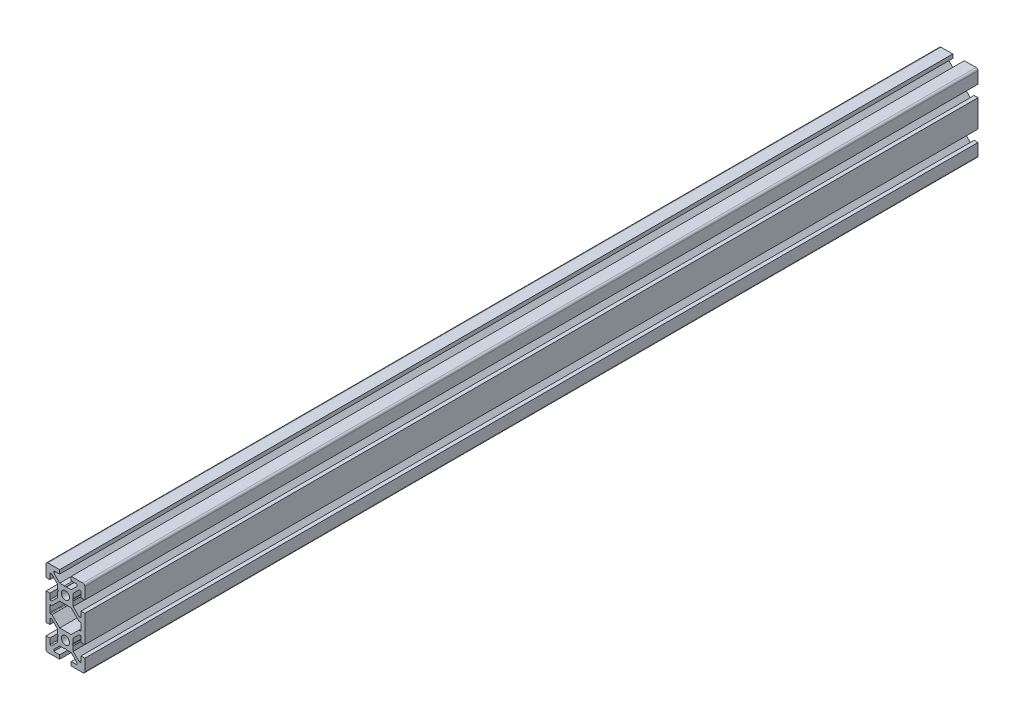
from build123d import *

# Parameters (mm, degrees)
BOSS_EXTRUDE1_DEPTH = 460
SKETCH2_W           = 460
SKETCH2_H           = 2.1
SKETCH3_W           = 460
SKETCH3_H           = 2.1


with BuildPart() as part:
    # Sketch1 → Boss-Extrude1 (new body)
    with BuildSketch(Plane.XY):
        with BuildLine():
            Line((-9, -20), (-3, -20))
            Line((-3, -20), (-3, -18))
            Line((-3, -18), (-6, -18))
            Line((-6, -18), (-6, -17.060660172))
            Line((-6, -17.060660172), (-2.939339828, -14))
            Line((-2.939339828, -14), (-0.519615242, -14))
            Line((-0.519615242, -14), (0, -13.7))
            Line((0, -13.7), (0.519615242, -14))
            Line((0.519615242, -14), (2.939339828, -14))
            Line((2.939339828, -14), (6, -17.060660172))
            Line((6, -17.060660172), (6, -18))
            Line((6, -18), (3, -18))
            Line((3, -18), (3, -20))
            Line((3, -20), (9, -20))
            ThreePointArc((9, -20), (9.707106781, -19.707106781), (10, -19))
            Line((10, -19), (10, -13))
            Line((10, -13), (8, -13))
            Line((8, -13), (8, -16))
            Line((8, -16), (7.060660172, -16))
            Line((7.060660172, -16), (4, -12.939339828))
            Line((4, -12.939339828), (4, -10.519615242))
            Line((4, -10.519615242), (3.7, -10))
            Line((3.7, -10), (4, -9.480384758))
            Line((4, -9.480384758), (4, -7.060660172))
            Line((4, -7.060660172), (7.060660172, -4))
            Line((7.060660172, -4), (8, -4))
            Line((8, -4), (8, -7))
            Line((8, -7), (10, -7))
            Line((10, -7), (10, 7))
            Line((10, 7), (8, 7))
            Line((8, 7), (8, 4))
            Line((8, 4), (7.060660172, 4))
            Line((7.060660172, 4), (4, 7.060660172))
            Line((4, 7.060660172), (4, 9.480384758))
            Line((4, 9.480384758), (3.7, 10))
            Line((3.7, 10), (4, 10.519615242))
            Line((4, 10.519615242), (4, 12.939339828))
            Line((4, 12.939339828), (7.060660172, 16))
            Line((7.060660172, 16), (8, 16))
            Line((8, 16), (8, 13))
            Line((8, 13), (10, 13))
            Line((10, 13), (10, 19))
            ThreePointArc((10, 19), (9.707106781, 19.707106781), (9, 20))
            Line((9, 20), (3, 20))
            Line((3, 20), (3, 18))
            Line((3, 18), (6, 18))
            Line((6, 18), (6, 17.060660172))
            Line((6, 17.060660172), (2.939339828, 14))
            Line((2.939339828, 14), (0.519615242, 14))
            Line((0.519615242, 14), (0, 13.7))
            Line((0, 13.7), (-0.519615242, 14))
            Line((-0.519615242, 14), (-2.939339828, 14))
            Line((-2.939339828, 14), (-6, 17.060660172))
            Line((-6, 17.060660172), (-6, 18))
            Line((-6, 18), (-3, 18))
            Line((-3, 18), (-3, 20))
            Line((-3, 20), (-9, 20))
            ThreePointArc((-9, 20), (-9.707106781, 19.707106781), (-10, 19))
            Line((-10, 19), (-10, 13))
            Line((-10, 13), (-8, 13))
            Line((-8, 13), (-8, 16))
            Line((-8, 16), (-7.060660172, 16))
            Line((-7.060660172, 16), (-4, 12.939339828))
            Line((-4, 12.939339828), (-4, 10.519615242))
            Line((-4, 10.519615242), (-3.7, 10))
            Line((-3.7, 10), (-4, 9.480384758))
            Line((-4, 9.480384758), (-4, 7.060660172))
            Line((-4, 7.060660172), (-7.060660172, 4))
            Line((-7.060660172, 4), (-8, 4))
            Line((-8, 4), (-8, 7))
            Line((-8, 7), (-10, 7))
            Line((-10, 7), (-10, -7))
            Line((-10, -7), (-8, -7))
            Line((-8, -7), (-8, -4))
            Line((-8, -4), (-7.060660172, -4))
            Line((-7.060660172, -4), (-4, -7.060660172))
            Line((-4, -7.060660172), (-4, -9.480384758))
            Line((-4, -9.480384758), (-3.7, -10))
            Line((-3.7, -10), (-4, -10.519615242))
            Line((-4, -10.519615242), (-4, -12.939339828))
            Line((-4, -12.939339828), (-7.060660172, -16))
            Line((-7.060660172, -16), (-8, -16))
            Line((-8, -16), (-8, -13))
            Line((-8, -13), (-10, -13))
            Line((-10, -13), (-10, -19))
            ThreePointArc((-10, -19), (-9.707106781, -19.707106781), (-9, -20))
        make_face()
        with BuildLine():
            Line((-7.7, -2), (-7.063603897, -2))
            ThreePointArc((-7.063603897, -2), (-6.948798867, -2.02283614), (-6.851471863, -2.087867966))
            Line((-6.851471863, -2.087867966), (-2.939339828, -6))
            Line((-2.939339828, -6), (2.939339828, -6))
            Line((2.939339828, -6), (6.851471863, -2.087867966))
            ThreePointArc((6.851471863, -2.087867966), (6.948798867, -2.02283614), (7.063603897, -2))
            Line((7.063603897, -2), (7.7, -2))
            ThreePointArc((7.7, -2), (7.912132034, -1.912132034), (8, -1.7))
            Line((8, -1.7), (8, 1.7))
            ThreePointArc((8, 1.7), (7.912132034, 1.912132034), (7.7, 2))
            Line((7.7, 2), (7.063603897, 2))
            ThreePointArc((7.063603897, 2), (6.948798867, 2.02283614), (6.851471863, 2.087867966))
            Line((6.851471863, 2.087867966), (2.939339828, 6))
            Line((2.939339828, 6), (-2.939339828, 6))
            Line((-2.939339828, 6), (-6.851471863, 2.087867966))
            ThreePointArc((-6.851471863, 2.087867966), (-6.948798867, 2.02283614), (-7.063603897, 2))
            Line((-7.063603897, 2), (-7.7, 2))
            ThreePointArc((-7.7, 2), (-7.912132034, 1.912132034), (-8, 1.7))
            Line((-8, 1.7), (-8, -1.7))
            ThreePointArc((-8, -1.7), (-7.912132034, -1.912132034), (-7.7, -2))
        make_face(mode=Mode.SUBTRACT)
    extrude(amount=-BOSS_EXTRUDE1_DEPTH)

    # Sketch2 → Cut-Revolve1 (revolve, cut)
    with BuildSketch(Plane(origin=(0, 0, 0), x_dir=(0, 0, -1), z_dir=(1, 0, 0)), mode=Mode.PRIVATE) as cut_revolve1_sk:
        with Locations((230, 11.05)):
            Rectangle(SKETCH2_W, SKETCH2_H)
    revolve(cut_revolve1_sk.sketch.rotate(Axis((0, 10, -460), (0, 0, 1)), 270), axis=Axis((0, 10, -460), (0, 0, 1)), mode=Mode.SUBTRACT)

    # Sketch3 → Cut-Revolve2 (revolve, cut)
    with BuildSketch(Plane(origin=(0, 0, 0), x_dir=(0, 0, -1), z_dir=(1, 0, 0)), mode=Mode.PRIVATE) as cut_revolve2_sk:
        with Locations((230, -8.95)):
            Rectangle(SKETCH3_W, SKETCH3_H)
    revolve(cut_revolve2_sk.sketch.rotate(Axis((0, -10, -460), (0, 0, 1)), 270), axis=Axis((0, -10, -460), (0, 0, 1)), mode=Mode.SUBTRACT)


solid = part.part
